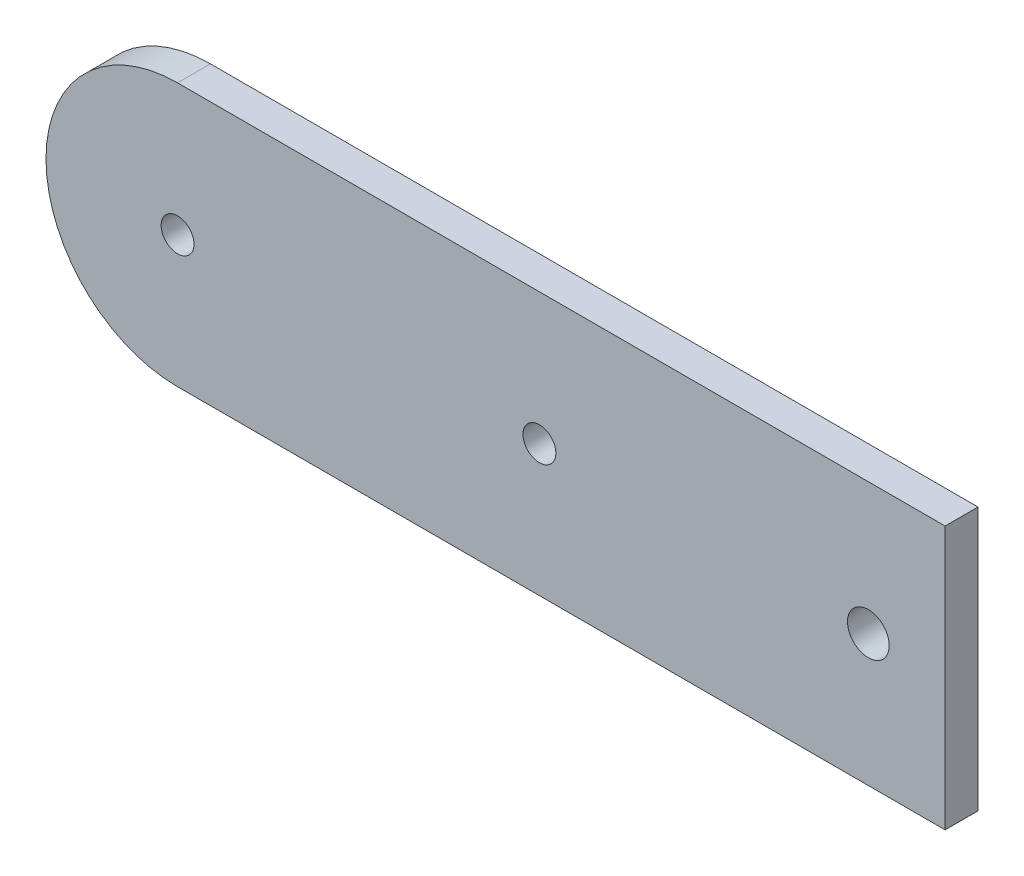
from build123d import *

# Parameters (mm, degrees)
ESQUISSE1_R        = 1.5
ESQUISSE1_R_2      = 1.902389191
BOSS_EXTRU_1_DEPTH = 3


with BuildPart() as part:
    # Esquisse1 → Boss.-Extru.1 (new body)
    with BuildSketch(Plane.XY):
        with BuildLine():
            Line((-70, 12), (0, 12))
            Line((0, 12), (0, -12))
            Line((0, -12), (-70, -12))
            ThreePointArc((-70, -12), (-82, 0), (-70, 12))
        make_face()
        with Locations((-37, 0)):
            Circle(ESQUISSE1_R, mode=Mode.SUBTRACT)
        with Locations((-70, 0)):
            Circle(ESQUISSE1_R, mode=Mode.SUBTRACT)
        with Locations((-7, 0)):
            Circle(ESQUISSE1_R_2, mode=Mode.SUBTRACT)
    extrude(amount=BOSS_EXTRU_1_DEPTH)


solid = part.part
